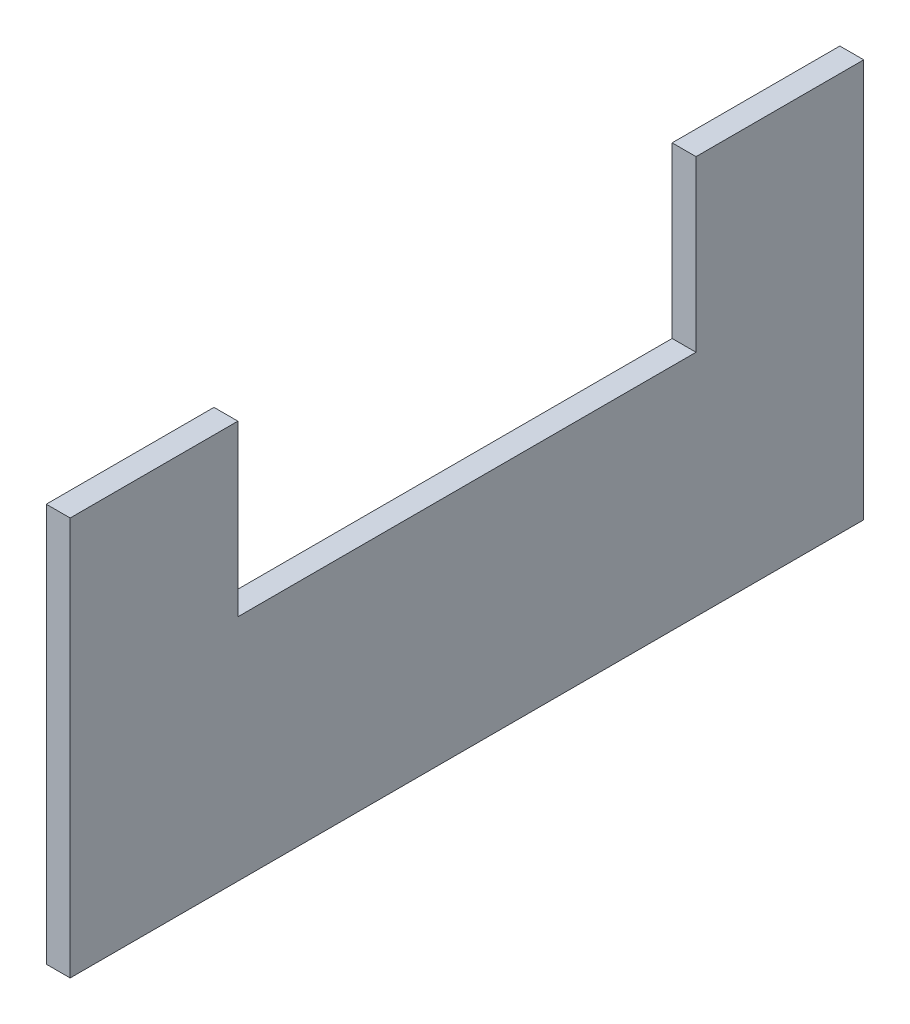
from build123d import *

# Parameters (mm, degrees)
BOSS_EXTRUDE1_DEPTH = 3


with BuildPart() as part:
    # Sketch1 → Boss-Extrude1 (new body)
    with BuildSketch(Plane(origin=(0, 0, 0), x_dir=(0, 0, -1), z_dir=(1, 0, 0))):
        Polygon((-49.8, 25), (-28.75, 25), (-28.75, 3.736915053), (28.75, 3.736915053), (28.75, 25), (49.8, 25), (49.8, -25), (-49.8, -25), align=None)
    extrude(amount=BOSS_EXTRUDE1_DEPTH)


solid = part.part
